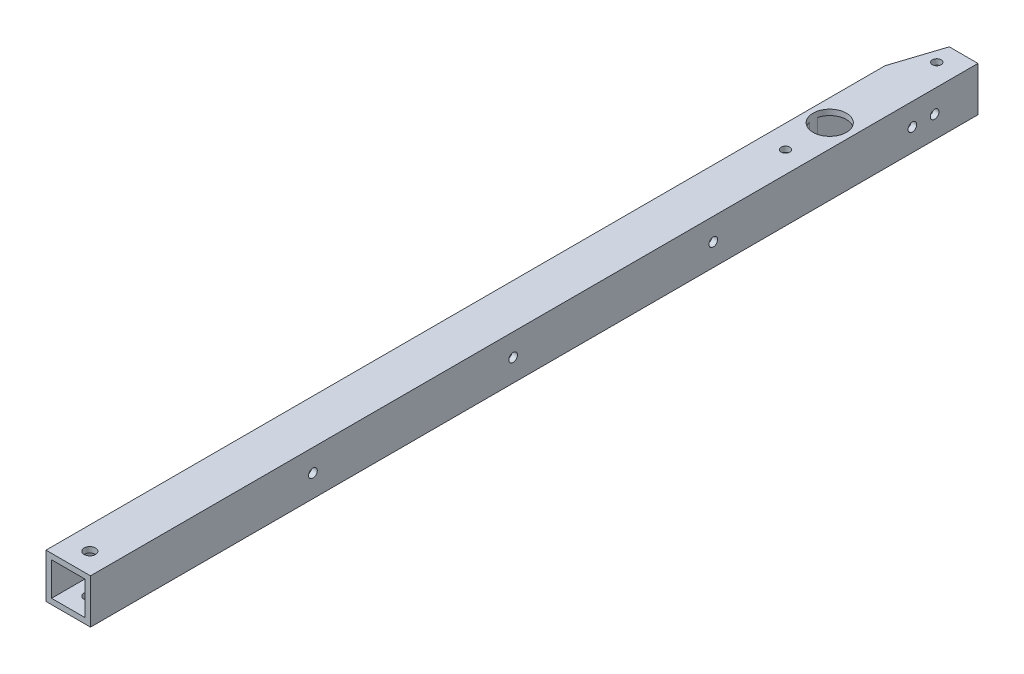
from build123d import *

# Parameters (mm, degrees)
BOSS_EXTRUDE1_DEPTH             = 260.35
BOSS_EXTRUDE1_DEPTH_BACK        = 260.35
SKETCH3_W                       = 25.4
SKETCH3_H                       = 25.4
SKETCH3_W_2                     = 19.05
SKETCH3_H_2                     = 19.05
CUT_EXTRUDE1_DEPTH              = 25.4
SKETCH5_R                       = 9.525
CUT_EXTRUDE2_DEPTH              = 262.894200967
F_10_CLEARANCE_HOLE2_D          = 4.9784
F_1_4_CLEARANCE_HOLE1_D         = 6.5278
F_10_CLEARANCE_HOLE3_D          = 4.9784
F_10_CLEARANCE_HOLE3_DEPTH      = 5.08
F_10_CLEARANCE_HOLE3_TIP        = 1.495662253
F_10_CLEARANCE_HOLE4_D          = 4.9784
F_1_4_0_25_DIAMETER_HOLE1_D     = 6.35
F_1_4_0_25_DIAMETER_HOLE1_DEPTH = 5.08
F_1_4_0_25_DIAMETER_HOLE1_TIP   = 1.907732465


with BuildPart() as part:
    # Sketch3 → Boss-Extrude1 (new, two sides: drawn at the far end of the back side and taken through both)
    with BuildSketch(Plane.XY.offset(-BOSS_EXTRUDE1_DEPTH_BACK)):
        Rectangle(SKETCH3_W, SKETCH3_H)
        Rectangle(SKETCH3_W_2, SKETCH3_H_2, mode=Mode.SUBTRACT)
    extrude(amount=BOSS_EXTRUDE1_DEPTH + BOSS_EXTRUDE1_DEPTH_BACK)

    # Sketch4 → Cut-Extrude1 (cut)
    with BuildSketch(Plane(origin=(0, 12.7, 0), x_dir=(1, 0, 0), z_dir=(0, 1, 0))):
        Polygon((-12.7, 218.66352), (-12.7, 260.35), (12.7, 260.35), (12.7, 246.38), (-3.69316, 246.38), align=None)
    extrude(amount=-CUT_EXTRUDE1_DEPTH, mode=Mode.SUBTRACT)

    # Sketch5 → Cut-Extrude2 (cut, through all)
    with BuildSketch(Plane.XZ.offset(-12.7)):
        with Locations((-0.278650599, -174.701227009)):
            Circle(SKETCH5_R)
    extrude(amount=CUT_EXTRUDE2_DEPTH, mode=Mode.SUBTRACT)

    # #10 Clearance Hole2 (through all)
    with Locations(Plane(origin=(0, -12.7, 0), x_dir=(-1, 0, 0), z_dir=(0, -1, 0))):
        with Locations((-0.379005456, 148.784459399), (-0.382415863, 235.170979471)):
            Hole(F_10_CLEARANCE_HOLE2_D / 2)

    # 1/4 Clearance Hole1 (through all)
    with Locations(Plane(origin=(0, -12.7, 0), x_dir=(-1, 0, 0), z_dir=(0, -1, 0))):
        with Locations((-0.363325871, -248.383604688)):
            Hole(F_1_4_CLEARANCE_HOLE1_D / 2)

    # #10 Clearance Hole3
    with Locations(Plane(origin=(12.7, 0, 0), x_dir=(0, 0, -1), z_dir=(1, 0, 0))):
        with Locations((221.61290974, -0.059596136), (208.915, 0)):
            Hole(F_10_CLEARANCE_HOLE3_D / 2, depth=F_10_CLEARANCE_HOLE3_DEPTH)
            with Locations((0, 0, -(F_10_CLEARANCE_HOLE3_DEPTH + F_10_CLEARANCE_HOLE3_TIP / 2))):  # 118° drill point
                Cone(0, F_10_CLEARANCE_HOLE3_D / 2, F_10_CLEARANCE_HOLE3_TIP, mode=Mode.SUBTRACT)

    # #10 Clearance Hole4 (through all)
    with Locations(Plane(origin=(12.7, 0, 0), x_dir=(0, 0, -1), z_dir=(1, 0, 0))):
        with Locations((-133.35, 0), (-19.05, 0), (95.25, 0)):
            Hole(F_10_CLEARANCE_HOLE4_D / 2)

    # 1/4 (0.25) Diameter Hole1
    with Locations(Plane.ZY.offset(12.7)):
        with Locations((101.6, 0), (228.6, 0)):
            Hole(F_1_4_0_25_DIAMETER_HOLE1_D / 2, depth=F_1_4_0_25_DIAMETER_HOLE1_DEPTH)
            with Locations((0, 0, -(F_1_4_0_25_DIAMETER_HOLE1_DEPTH + F_1_4_0_25_DIAMETER_HOLE1_TIP / 2))):  # 118° drill point
                Cone(0, F_1_4_0_25_DIAMETER_HOLE1_D / 2, F_1_4_0_25_DIAMETER_HOLE1_TIP, mode=Mode.SUBTRACT)


solid = part.part
